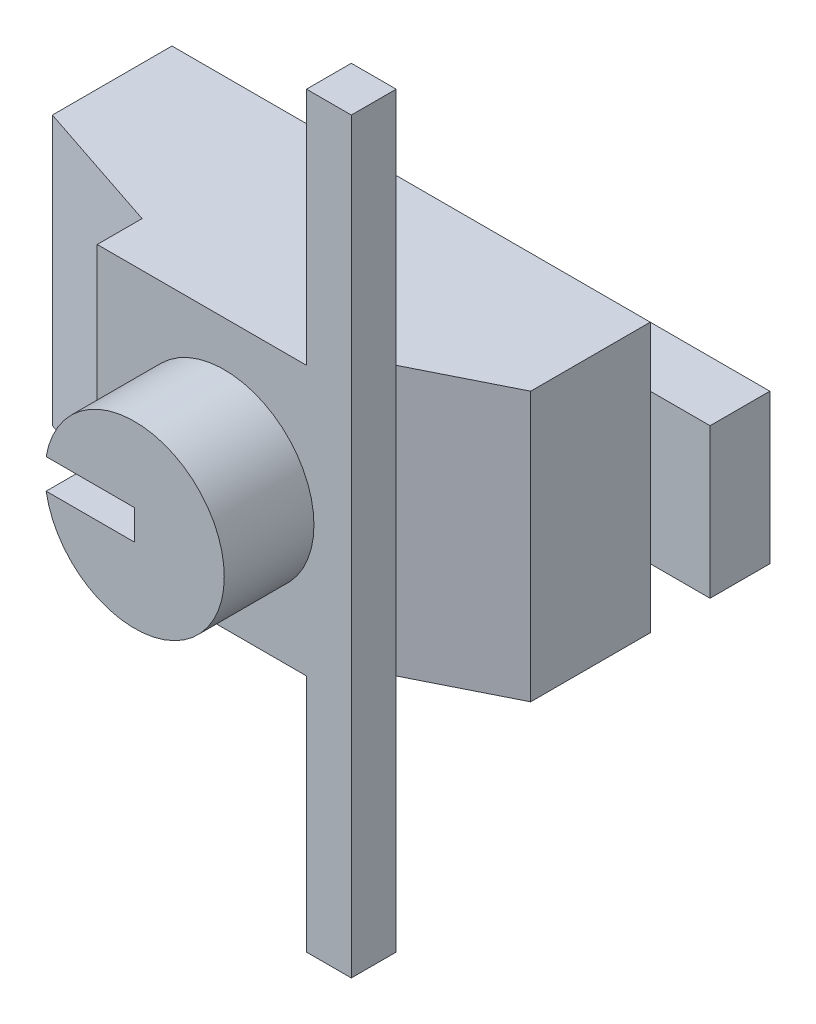
from build123d import *

# Parameters (mm, degrees)
SKETCH_1_W          = 200
SKETCH_1_H          = 50
EXTRUDE_1_DEPTH     = 20
SKETCH_2_W          = 160
SKETCH_2_H          = 90
EXTRUDE_2_DEPTH     = 40
SKETCH_3_W          = 15
SKETCH_3_H          = 15
EXTRUDE_3_DEPTH     = 90
EXTRUDE_START       = -45
SKETCH_5_W          = 15
SKETCH_5_H          = 15
EXTRUDE_4_DEPTH     = 125
SKETCH_6_R          = 30
EXTRUDE_5_DEPTH     = 30
SKETCH_7_W          = 30
SKETCH_7_H          = 5
CUT_EXTRUDE_2_DEPTH = 30


with BuildPart() as part:
    # Эскиз1 → Бобышка-Вытянуть1 (new body)
    with BuildSketch(Plane.XY):
        with Locations((100, -25)):
            Rectangle(SKETCH_1_W, SKETCH_1_H)
    extrude(amount=EXTRUDE_1_DEPTH)

    # Эскиз2 → Бобышка-Вытянуть2 (add)
    with BuildSketch(Plane.XY.offset(20)):
        with Locations((100, -25)):
            Rectangle(SKETCH_2_W, SKETCH_2_H)
    extrude(amount=EXTRUDE_2_DEPTH)

    # Эскиз3 → Бобышка-Вытянуть3 (add)
    with BuildSketch(Plane.XZ.offset(70)):
        Polygon((65, 90), (65, 75), (65, 60), (135, 60), (135, 75), (135, 90), align=None)
        with Locations((142.5, 82.5)):
            Rectangle(SKETCH_3_W, SKETCH_3_H)
        Polygon((135, 75), (135, 60), (180, 60), (150, 75), align=None)
        Polygon((65, 75), (20, 60), (65, 60), align=None)
    extrude(amount=-EXTRUDE_3_DEPTH)

    # Эскиз5 → Бобышка-Вытянуть4 (add, symmetric)
    with BuildSketch(Plane(origin=(0, 20, 0), x_dir=(1, 0, 0), z_dir=(0, 1, 0)).offset(EXTRUDE_START)):
        with Locations((142.5, -82.5)):
            Rectangle(SKETCH_5_W, SKETCH_5_H)
    extrude(amount=EXTRUDE_4_DEPTH, both=True)

    # Эскиз6 → Бобышка-Вытянуть5 (add)
    with BuildSketch(Plane.XY.offset(90)):
        with Locations((107.5, -25)):
            Circle(SKETCH_6_R)
    extrude(amount=EXTRUDE_5_DEPTH)

    # Эскиз7 → Вырез-Вытянуть2 (cut)
    with BuildSketch(Plane.XY.offset(120)):
        with Locations((92.5, -27.5)):
            Rectangle(SKETCH_7_W, SKETCH_7_H)
        with Locations((92.5, -22.5)):
            Rectangle(SKETCH_7_W, SKETCH_7_H)
    extrude(amount=-CUT_EXTRUDE_2_DEPTH, mode=Mode.SUBTRACT)


solid = part.part
